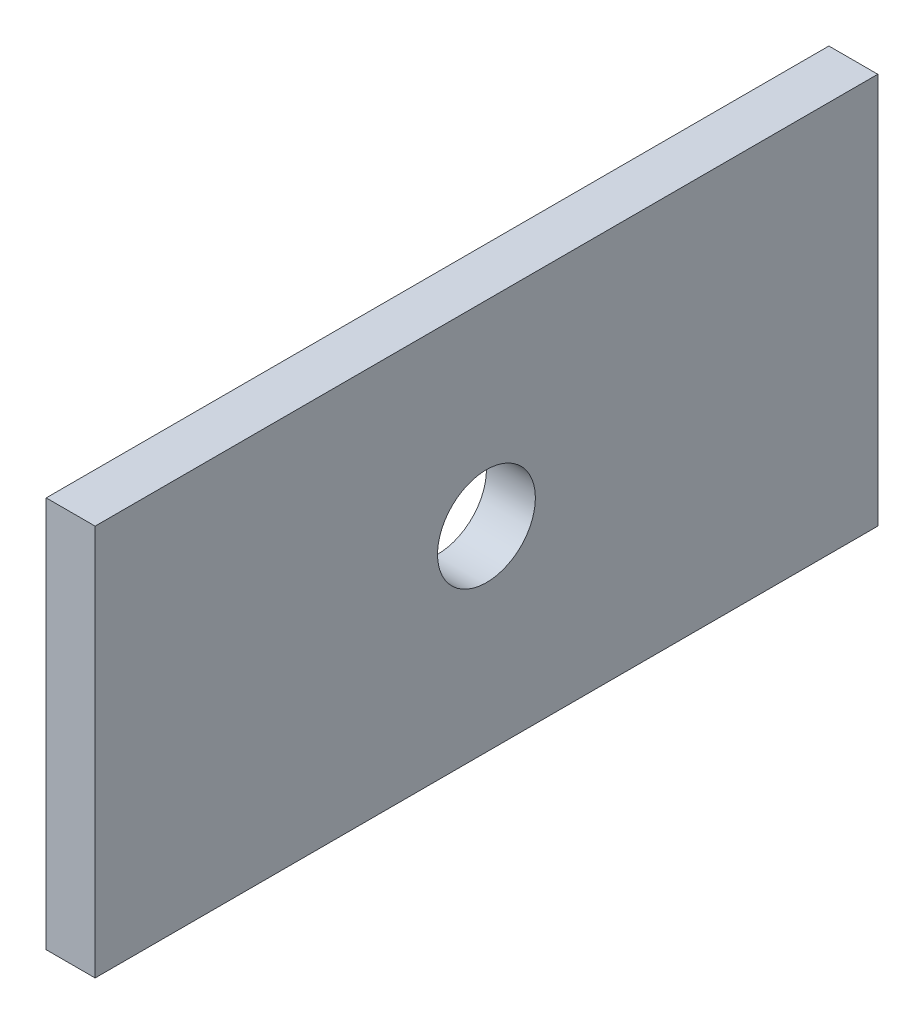
from build123d import *

# Parameters (mm, degrees)
SKETCH1_W           = 50.8
SKETCH1_H           = 25.4
BOSS_EXTRUDE1_DEPTH = 3.175
SKETCH2_R           = 3.175
CUT_EXTRUDE1_DEPTH  = 29.575


with BuildPart() as part:
    # Sketch1 → Boss-Extrude1 (new body)
    with BuildSketch(Plane(origin=(0, 0, 0), x_dir=(0, 0, -1), z_dir=(1, 0, 0))):
        Rectangle(SKETCH1_W, SKETCH1_H)
    extrude(amount=BOSS_EXTRUDE1_DEPTH)

    # Sketch2 → Cut-Extrude1 (cut, through all)
    with BuildSketch(Plane(origin=(3.175, 0, 0), x_dir=(0, 0, -1), z_dir=(1, 0, 0))):
        Circle(SKETCH2_R)
    extrude(amount=-CUT_EXTRUDE1_DEPTH, mode=Mode.SUBTRACT)


solid = part.part
